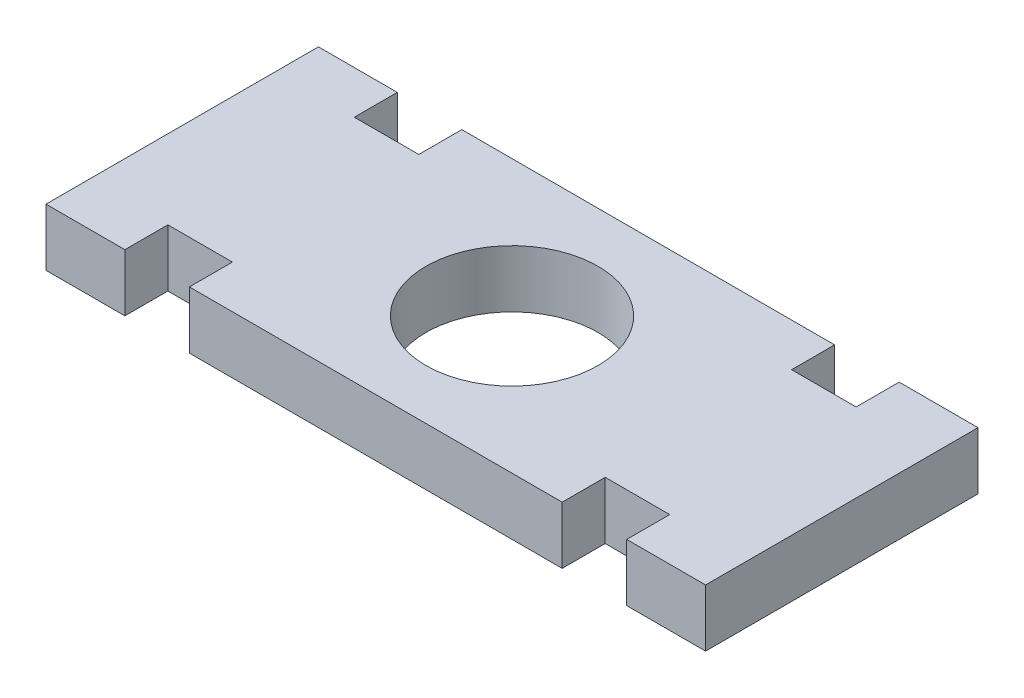
from build123d import *

# Parameters (mm, degrees)
SKETCH_1_R      = 6
EXTRUDE_1_DEPTH = 4


with BuildPart() as part:
    # ｽｹｯﾁ1 → ﾎﾞｽ - 押し出し1 (new body)
    with BuildSketch(Plane(origin=(0, 0, 0), x_dir=(1, 0, 0), z_dir=(0, 1, 0))):
        Polygon((0, 0), (-5.5, 0), (-5.5, 3), (-10, 3), (-10, 0), (-36, 0), (-36, 3), (-40.5, 3), (-40.5, 0), (-46, 0), (-46, 19), (-40.5, 19), (-40.5, 16), (-36, 16), (-36, 19), (-10, 19), (-10, 16), (-5.5, 16), (-5.5, 19), (0, 19), align=None)
        with Locations(Location((-23, 9.5, 0), (0, 0, 270))):
            Circle(SKETCH_1_R, mode=Mode.SUBTRACT)
    extrude(amount=EXTRUDE_1_DEPTH)


solid = part.part
